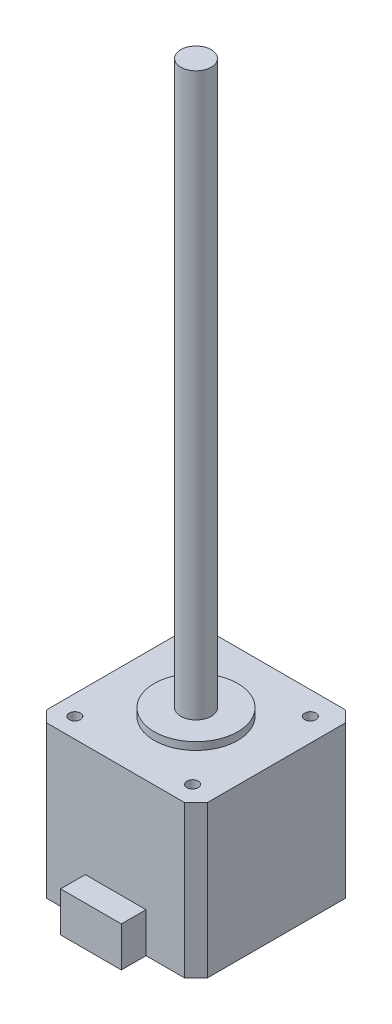
from build123d import *

# Parameters (mm, degrees)
SALIENTE_EXTRUIR1_DEPTH = 40
CROQUIS2_R              = 1.5
CORTAR_EXTRUIR2_DEPTH   = 4.5
CROQUIS3_R              = 11
CROQUIS3_R_2            = 4
SALIENTE_EXTRUIR3_DEPTH = 2
CROQUIS8_R              = 4
SALIENTE_EXTRUIR4_DEPTH = 150
CROQUIS9_W              = 16
CROQUIS9_H              = 10.5
SALIENTE_EXTRUIR6_DEPTH = 6.5


with BuildPart() as part:
    # Croquis1 → Saliente-Extruir1 (new body)
    with BuildSketch(Plane(origin=(0, 0, 0), x_dir=(1, 0, 0), z_dir=(0, 1, 0))):
        Polygon((-18.15, -21.15), (18.15, -21.15), (21.15, -18.15), (21.15, 18.15), (18.15, 21.15), (-18.15, 21.15), (-21.15, 18.15), (-21.15, -18.15), align=None)
    extrude(amount=SALIENTE_EXTRUIR1_DEPTH)

    # Croquis2 → Cortar-Extruir2 (cut)
    with BuildSketch(Plane(origin=(0, 40, 0), x_dir=(1, 0, 0), z_dir=(0, 1, 0))):
        with Locations(Location((15.05, 15.05, 0), (0, 0, 270))):
            Circle(CROQUIS2_R)
        with Locations(Location((-15.95, 15.05, 0), (0, 0, 270))):
            Circle(CROQUIS2_R)
        with Locations(Location((-15.95, -15.95, 0), (0, 0, 270))):
            Circle(CROQUIS2_R)
        with Locations(Location((15.05, -15.95, 0), (0, 0, 270))):
            Circle(CROQUIS2_R)
    extrude(amount=-CORTAR_EXTRUIR2_DEPTH, mode=Mode.SUBTRACT)

    # Croquis3 → Saliente-Extruir3 (add)
    with BuildSketch(Plane(origin=(0, 40, 0), x_dir=(1, 0, 0), z_dir=(0, 1, 0))):
        with Locations(Location((0, 0, 0), (0, 0, 90))):
            Circle(CROQUIS3_R)
        with Locations(Location((0, 0, 0), (0, 0, 270))):
            Circle(CROQUIS3_R_2, mode=Mode.SUBTRACT)
    extrude(amount=SALIENTE_EXTRUIR3_DEPTH)

    # Croquis8 → Saliente-Extruir4 (add)
    with BuildSketch(Plane(origin=(0, 40, 0), x_dir=(1, 0, 0), z_dir=(0, 1, 0))):
        with Locations(Location((0, 0, 0), (0, 0, 270))):
            Circle(CROQUIS8_R)
    extrude(amount=SALIENTE_EXTRUIR4_DEPTH)

    # Croquis9 → Saliente-Extruir6 (add)
    with BuildSketch(Plane.XY.offset(21.15)):
        with Locations((0, 5.25)):
            Rectangle(CROQUIS9_W, CROQUIS9_H)
    extrude(amount=SALIENTE_EXTRUIR6_DEPTH)


solid = part.part
